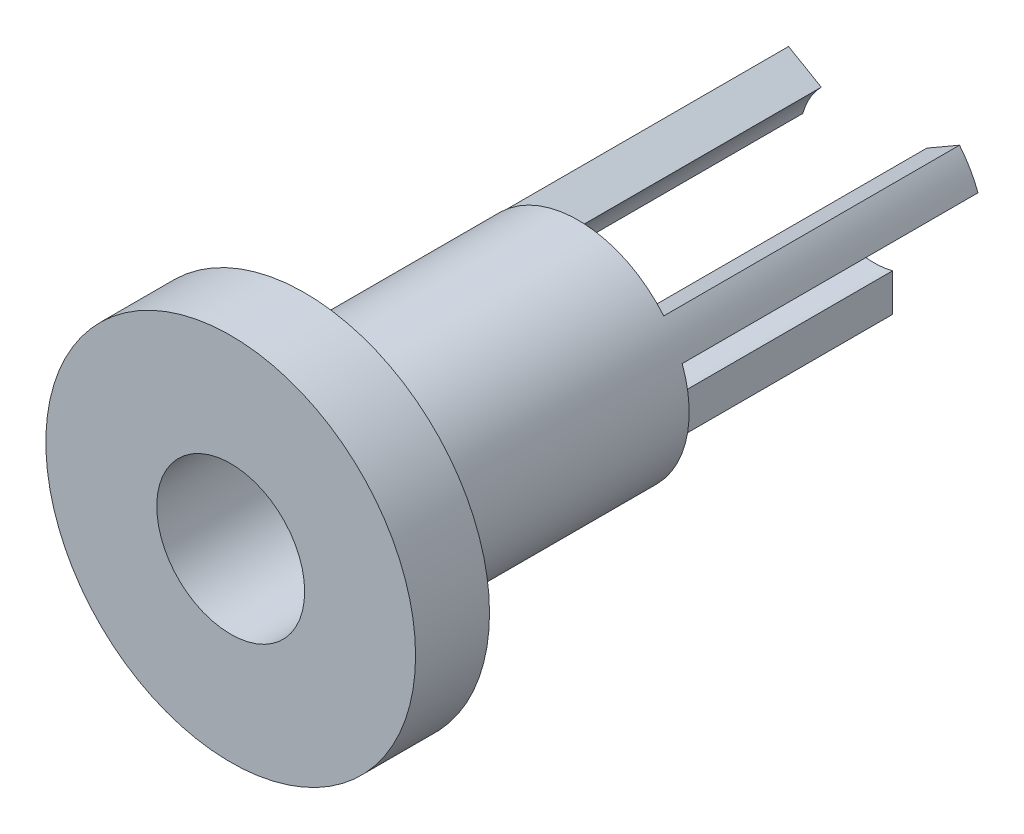
from build123d import *
from build123d.topology import SkipClean

# Parameters (mm, degrees)
SKETCH1_R           = 0.75
SKETCH1_R_2         = 0.5
BOSS_EXTRUDE1_DEPTH = 1.85
SKETCH2_R           = 1.25
SKETCH2_R_2         = 0.5
BOSS_EXTRUDE2_DEPTH = 0.5
BOSS_EXTRUDE3_START = 2
BOSS_EXTRUDE3_DEPTH = 2


with BuildPart() as part:
    # Sketch1 → Boss-Extrude1 (new body)
    with BuildSketch(Plane.XY):
        Circle(SKETCH1_R)
        Circle(SKETCH1_R_2, mode=Mode.SUBTRACT)
    extrude(amount=BOSS_EXTRUDE1_DEPTH)

    # Sketch2 → Boss-Extrude2 (add)
    with BuildSketch(Plane.XY.offset(1.85)):
        Circle(SKETCH2_R)
        Circle(SKETCH2_R_2, mode=Mode.SUBTRACT)
    extrude(amount=BOSS_EXTRUDE2_DEPTH)

    # Sketch4 → Boss-Extrude3 (add)
    with SkipClean():  # the faces are left unmerged after this step: merging them gives an invalid solid
        with BuildSketch(Plane(origin=(0, 0, 0), x_dir=(-1, 0, 0), z_dir=(0, 0, -1)).offset(BOSS_EXTRUDE3_START)):
            with BuildLine():
                Line((-0.356762746, 0.350314635), (-0.577934423, 0.478008162))
                ThreePointArc((-0.577934423, 0.478008162), (-0.615884067, 0.42800329), (-0.649519059, 0.374999989))
                ThreePointArc((-0.649519059, 0.374999989), (-0.678603761, 0.319369591), (-0.702934423, 0.261501811))
                Line((-0.702934423, 0.261501811), (-0.481762746, 0.133808284))
                ThreePointArc((-0.481762746, 0.133808284), (-0.433012702, 0.25), (-0.356762746, 0.350314635))
            make_face()
            with BuildLine():
                ThreePointArc((0.702934423, 0.261501811), (0.678603761, 0.319369591), (0.649519059, 0.374999989))
                ThreePointArc((0.649519059, 0.374999989), (0.615884067, 0.42800329), (0.577934423, 0.478008162))
                Line((0.577934423, 0.478008162), (0.356762746, 0.350314635))
                ThreePointArc((0.356762746, 0.350314635), (0.433012702, 0.25), (0.481762746, 0.133808284))
                Line((0.481762746, 0.133808284), (0.702934423, 0.261501811))
            make_face()
            with BuildLine():
                ThreePointArc((0, -0.75), (0.062719695, -0.747372892), (0.125, -0.739509973))
                Line((0.125, -0.739509973), (0.125, -0.484122918))
                ThreePointArc((0.125, -0.484122918), (0, -0.5), (-0.125, -0.484122918))
                Line((-0.125, -0.484122918), (-0.125, -0.739509973))
                ThreePointArc((-0.125, -0.739509973), (-0.062719695, -0.747372892), (0, -0.75))
            make_face()
        extrude(amount=-BOSS_EXTRUDE3_DEPTH)


solid = part.part
